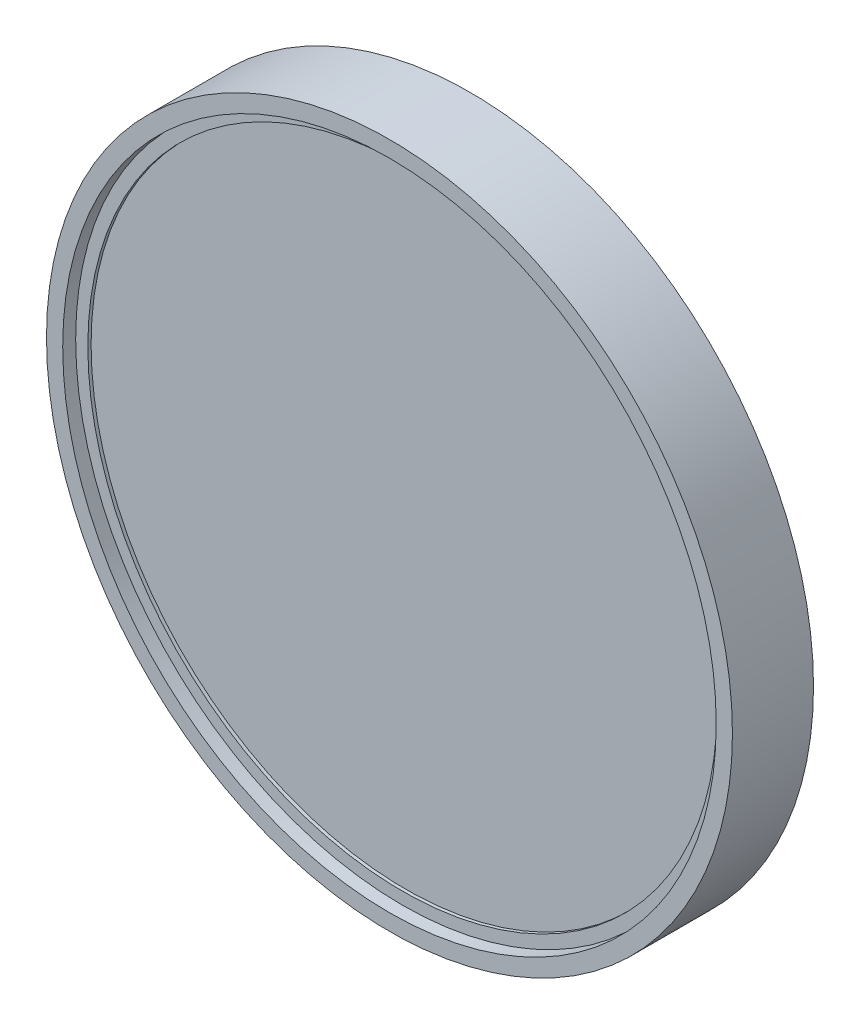
from build123d import *

# Parameters (mm, degrees)
BACKER_MAIN_R              = 26.8605
BOSS_EXTRUDE1_DEPTH        = 6.35
SUBSTRATE_BACK_CLEARANCE_R = 24.638
CUT_EXTRUDE1_DEPTH         = 1.27
SUBSTRATE_CSINK_R          = 25.5905
CUT_EXTRUDE2_DEPTH         = 1.016
SPRING_HOLE_R              = 4.8895
CUT_EXTRUDE3_DEPTH         = 3.175


with BuildPart() as part:
    # Backer Main → Boss-Extrude1 (new body)
    with BuildSketch(Plane.XY):
        Circle(BACKER_MAIN_R)
    extrude(amount=-BOSS_EXTRUDE1_DEPTH)

    # Substrate Back Clearance → Cut-Extrude1 (cut)
    with BuildSketch(Plane.XY):
        Circle(SUBSTRATE_BACK_CLEARANCE_R)
    extrude(amount=-CUT_EXTRUDE1_DEPTH, mode=Mode.SUBTRACT)

    # Substrate CSink → Cut-Extrude2 (cut)
    with BuildSketch(Plane.XY):
        Circle(SUBSTRATE_CSINK_R)
    extrude(amount=-CUT_EXTRUDE2_DEPTH, mode=Mode.SUBTRACT)

    # Spring Hole → Cut-Extrude3 (cut)
    with BuildSketch(Plane(origin=(0, 0, -6.35), x_dir=(-1, 0, 0), z_dir=(0, 0, -1))):
        Circle(SPRING_HOLE_R)
    extrude(amount=-CUT_EXTRUDE3_DEPTH, mode=Mode.SUBTRACT)


solid = part.part
